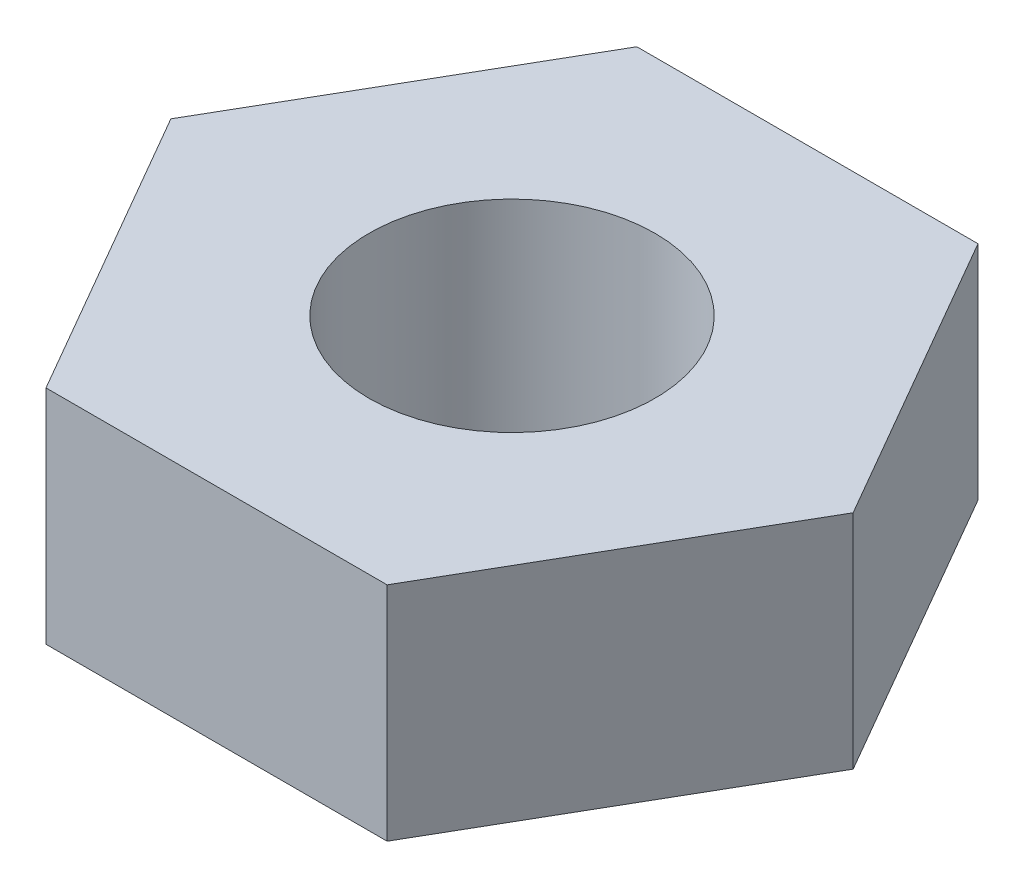
from build123d import *

# Parameters (mm, degrees)
BOSS_EXTRUDE1_DEPTH = 1.18
SKETCH2_R           = 0.76
CUT_EXTRUDE1_DEPTH  = 3.672795041


with BuildPart() as part:
    # Sketch1 → Boss-Extrude1 (new body)
    with BuildSketch(Plane(origin=(0, 0, 0), x_dir=(1, 0, 0), z_dir=(0, 1, 0))):
        Polygon((1.812879845, 0), (0.906439923, 1.57), (-0.906439923, 1.57), (-1.812879845, 0), (-0.906439923, -1.57), (0.906439923, -1.57), align=None)
    extrude(amount=BOSS_EXTRUDE1_DEPTH)

    # Sketch2 → Cut-Extrude1 (cut, through all)
    with BuildSketch(Plane(origin=(0, 1.18, 0), x_dir=(1, 0, 0), z_dir=(0, 1, 0))):
        with Locations(Location((0, 0, 0), (0, 0, 270))):
            Circle(SKETCH2_R)
    extrude(amount=-CUT_EXTRUDE1_DEPTH, mode=Mode.SUBTRACT)


solid = part.part
